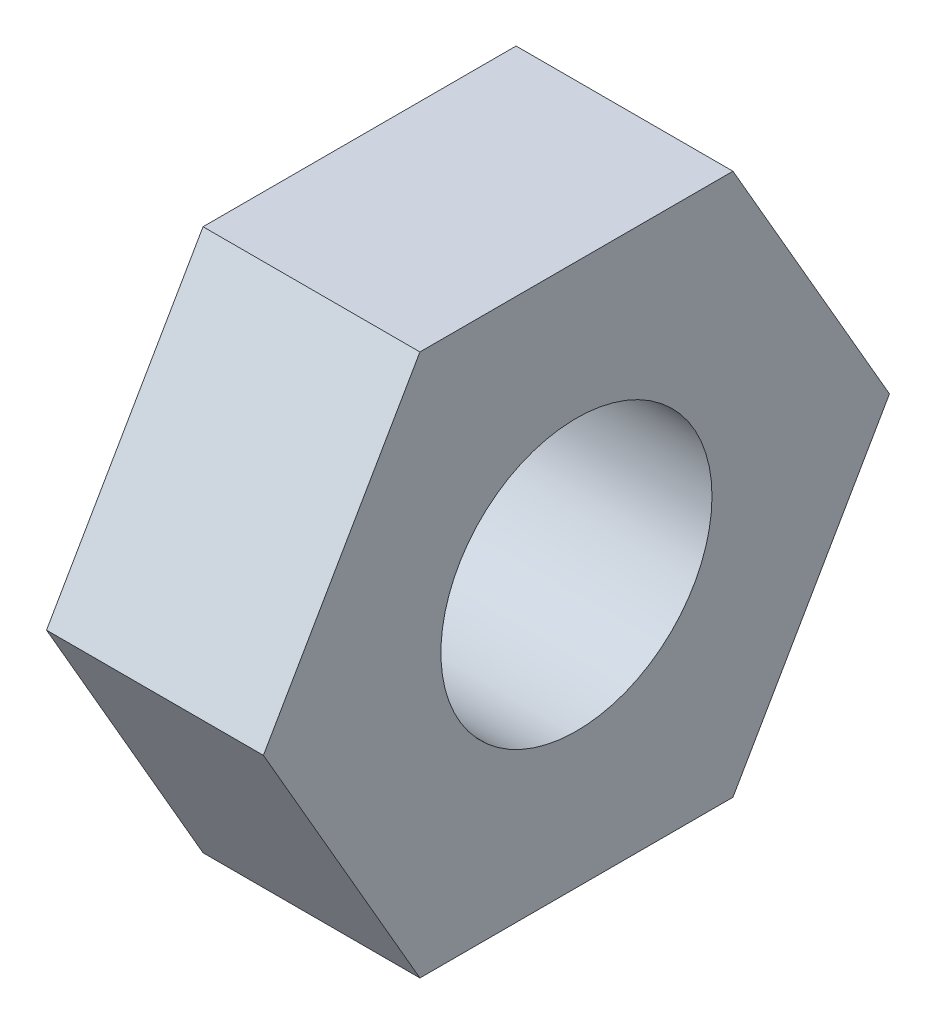
from build123d import *

# Parameters (mm, degrees)
NUT_DEPTH       = 1.6
THREAD_SKETCH_W = 3.6
THREAD_SKETCH_H = 1


with BuildPart() as part:
    # Nut Sketch → Nut (new body)
    with BuildSketch(Plane(origin=(0, 0, 0), x_dir=(0, 0, -1), z_dir=(1, 0, 0))):
        Polygon((2.309401077, 0), (1.154700538, 2), (-1.154700538, 2), (-2.309401077, 0), (-1.154700538, -2), (1.154700538, -2), align=None)
    extrude(amount=NUT_DEPTH)

    # Thread Sketch → Thread (revolve, cut)
    with BuildSketch(Plane.XY):
        with Locations((0.8, 0.5)):
            Rectangle(THREAD_SKETCH_W, THREAD_SKETCH_H)
    revolve(axis=Axis((-1000, 0, 0), (1, 0, 0)), mode=Mode.SUBTRACT)


solid = part.part
